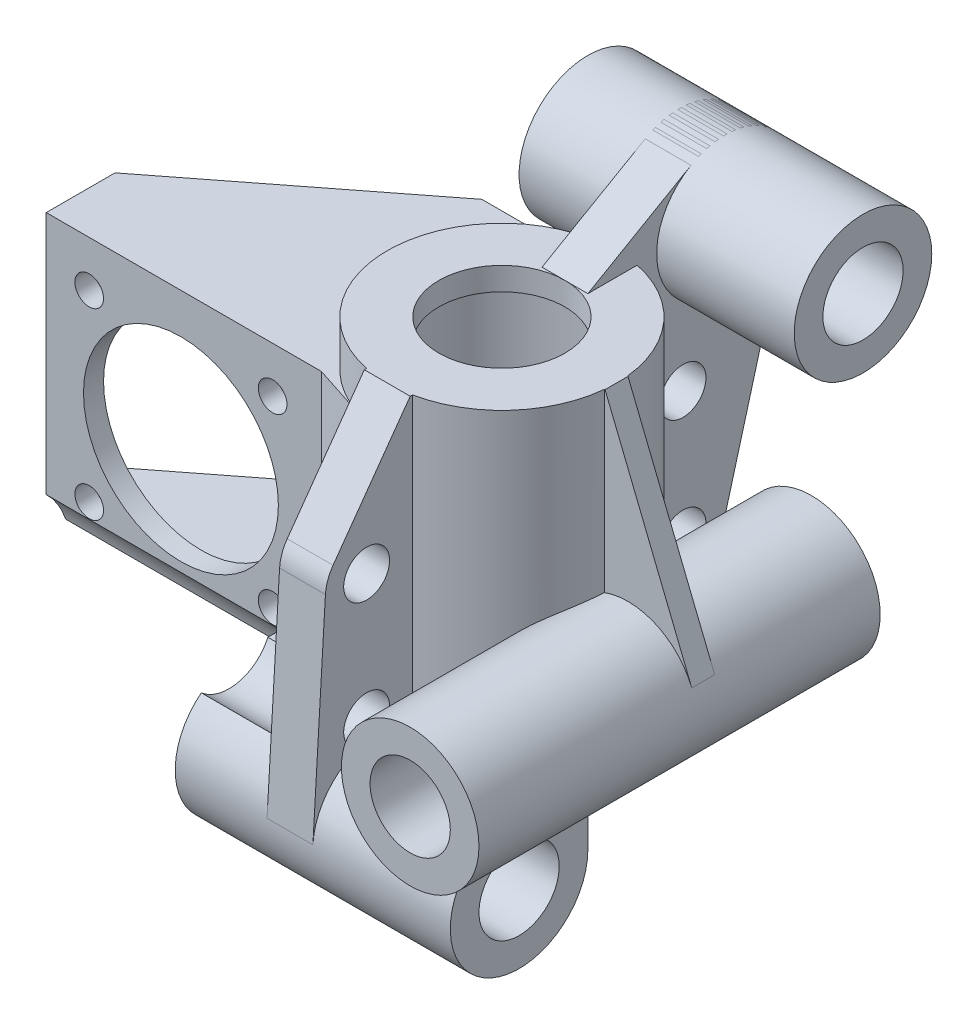
from build123d import *

# Parameters (mm, degrees)
BOSS_EXTRUDE3_DEPTH           = 14
BOSS_EXTRUDE3_DEPTH_BACK      = 10
SKETCH6_R                     = 6
SKETCH6_R_2                   = 3.5
BOSS_EXTRUDE_MOUNT_DEPTH      = 11
BOSS_EXTRUDE_MOUNT_DEPTH_BACK = 13
SKETCH11_R                    = 3.5
SKETCH11_R_2                  = 2
BOSS_EXTRUDE_FLANGE_DEPTH     = 2
CUT_EXTRUDE2_DEPTH            = 10.5
CUT_EXTRUDE2_DEPTH_BACK       = 47.360004387
SKETCH8_W                     = 30
SKETCH8_H                     = 20.5
SKETCH9_R                     = 6.5
CUT_EXTRUDE3_DEPTH            = 40.613760296
SKETCH10_R                    = 8.5
SKETCH10_R_2                  = 1.25
CUT_EXTRUDE4_DEPTH            = 1.75
BOSS_EXTRUDE6_DEPTH           = 20
BOSS_EXTRUDE6_DEPTH_BACK      = 15
SKETCH12_R                    = 6
SKETCH12_R_2                  = 3.5
SKETCH13_R                    = 3
CUT_EXTRUDE5_DEPTH            = 5
SKETCH14_R                    = 3.7
CUT_EXTRUDE6_DEPTH            = 44.339502814
BOSS_EXTRUDE7_DEPTH           = 1
CUT_EXTRUDE7_START            = -2
SKETCH16_R                    = 2
CUT_EXTRUDE7_DEPTH            = 9.5


with BuildPart() as part:
    # Sketch2 → Revolve1 (revolve)
    with BuildSketch(Plane(origin=(0, 0, 0), x_dir=(0, 0, -1), z_dir=(1, 0, 0)), mode=Mode.PRIVATE) as revolve1_sk:
        Polygon((5.5, 15), (5.5, 13), (7.75, 13), (7.75, -13), (5.5, -13), (5.5, -15), (10, -15), (10, 15), align=None)
    revolve(revolve1_sk.sketch.rotate(Axis((0, 15, 0), (0, -1, 0)), 180), axis=Axis((0, 15, 0), (0, -1, 0)))

    # Sketch6 → Boss-Extrude3 (add, two sides: drawn at the far end of the back side and taken through both)
    # profile 1 of 2: a face of its own
    with BuildSketch(Plane(origin=(0, 0, 0), x_dir=(0, 0, -1), z_dir=(1, 0, 0)).offset(-BOSS_EXTRUDE3_DEPTH_BACK)):
        with Locations((17.5, 15)):
            Circle(SKETCH6_R)
        with Locations((17.5, 15)):
            Circle(SKETCH6_R_2, mode=Mode.SUBTRACT)
    # profile 2 of 2: a face of its own
    with BuildSketch(Plane(origin=(0, 0, 0), x_dir=(0, 0, -1), z_dir=(1, 0, 0)).offset(-BOSS_EXTRUDE3_DEPTH_BACK)):
        with BuildLine():
            Line((-12.5, -9), (-6.5, -9))
            Line((-6.5, -9), (-6.5, -15))
            ThreePointArc((-6.5, -15), (-16.742640687, -19.242640687), (-12.5, -9))
        make_face()
        with Locations((-12.5, -15)):
            Circle(SKETCH6_R_2, mode=Mode.SUBTRACT)
    extrude(amount=BOSS_EXTRUDE3_DEPTH + BOSS_EXTRUDE3_DEPTH_BACK)


with BuildPart() as boss_extrude3_piece_1:
    # of the separate pieces the step leaves, piece 1, a body of its own (boss_extrude3_pieces)
    add(part.part.solids().sort_by_distance((0, 15, 5.5))[0])

    # Sketch7 → Boss-Extrude Mount (add, two sides: drawn at the far end of the back side and taken through both)
    with BuildSketch(Plane(origin=(0, 0, 0), x_dir=(1, 0, 0), z_dir=(0, 1, 0)).offset(-BOSS_EXTRUDE_MOUNT_DEPTH_BACK)):
        with BuildLine():
            Line((-7.75, -8), (-31.75, -8))
            Line((-31.75, -8), (-31.75, -2))
            Line((-31.75, -2), (-13.75, 12))
            Line((-13.75, 12), (0, 12))
            Line((0, 12), (0, 10))
            ThreePointArc((0, 10), (-9.877414793, 1.560985907), (-3.083701059, -9.512664599))
            Line((-3.083701059, -9.512664599), (-7.75, -8))
        make_face()
    extrude(amount=BOSS_EXTRUDE_MOUNT_DEPTH + BOSS_EXTRUDE_MOUNT_DEPTH_BACK)

    # Sketch11 → Boss-Extrude Flange (add, symmetric)
    with BuildSketch(Plane(origin=(0, 0, 0), x_dir=(0, 0, -1), z_dir=(1, 0, 0))):
        with BuildLine():
            Line((-10, 15), (5.5, 15))
            Line((5.5, 15), (14.5, 20.196152423))
            ThreePointArc((14.5, 20.196152423), (21.168339425, 19.747977029), (23.28512436, 13.408668439))
            Line((23.28512436, 13.408668439), (17.271074616, -8.454798937))
            ThreePointArc((17.271074616, -8.454798937), (16.791511099, -9.502713495), (16.005385537, -10.345395339))
            Line((16.005385537, -10.345395339), (10, -15))
            Line((10, -15), (-6.5, -15))
            ThreePointArc((-6.5, -15), (-12.678832382, -20.997334323), (-18.48933966, -14.642494138))
            Line((-18.48933966, -14.642494138), (-17.393603796, 3.714503517))
            ThreePointArc((-17.393603796, 3.714503517), (-17.193582714, 4.701497551), (-16.728001829, 5.594470169))
            Line((-16.728001829, 5.594470169), (-10, 15))
        make_face()
        with Locations((-12.5, -15)):
            Circle(SKETCH11_R, mode=Mode.SUBTRACT)
        with Locations((17.5, 15)):
            Circle(SKETCH11_R, mode=Mode.SUBTRACT)
        with Locations((-13.8, -7.5)):
            Circle(SKETCH11_R_2, mode=Mode.SUBTRACT)
        with Locations((-13.8, 3.5)):
            Circle(SKETCH11_R_2, mode=Mode.SUBTRACT)
        with Locations(Location((13.8, 3.5, 0), (0, 0, 154.158067237))):
            Circle(SKETCH11_R_2, mode=Mode.SUBTRACT)
        with Locations(Location((13.8, -7.5, 0), (0, 0, 154.158067237))):
            Circle(SKETCH11_R_2, mode=Mode.SUBTRACT)
    extrude(amount=BOSS_EXTRUDE_FLANGE_DEPTH, both=True)

    # Sketch8 → Cut-Extrude2 (cut, two sides: drawn at the far end of the back side and taken through both)
    with BuildSketch(Plane(origin=(-20, 0, 0), x_dir=(0, 0, -1), z_dir=(1, 0, 0)).offset(-CUT_EXTRUDE2_DEPTH_BACK)):
        with Locations((8.75, -1)):
            Rectangle(SKETCH8_W, SKETCH8_H)
    extrude(amount=CUT_EXTRUDE2_DEPTH + CUT_EXTRUDE2_DEPTH_BACK, mode=Mode.SUBTRACT)

    # Sketch9 → Cut-Extrude3 (cut, through all)
    with BuildSketch(Plane.ZY.offset(10)):
        with Locations((-17.5, 15)):
            Circle(SKETCH9_R)
        with Locations((12.5, -15)):
            Circle(SKETCH9_R)
    extrude(amount=CUT_EXTRUDE3_DEPTH, mode=Mode.SUBTRACT)

    # Sketch10 → Cut-Extrude4 (cut)
    with BuildSketch(Plane.XY.offset(8)):
        with Locations((-20, -1)):
            Circle(SKETCH10_R)
        with Locations((-12, 7)):
            Circle(SKETCH10_R_2)
        with Locations((-28, 7)):
            Circle(SKETCH10_R_2)
        with Locations((-28, -9)):
            Circle(SKETCH10_R_2)
        with Locations((-12, -9)):
            Circle(SKETCH10_R_2)
    extrude(amount=-CUT_EXTRUDE4_DEPTH, mode=Mode.SUBTRACT)

    # Sketch12 → Boss-Extrude6 (add, two sides: drawn at the far end of the back side and taken through both)
    with BuildSketch(Plane.XY.offset(-BOSS_EXTRUDE6_DEPTH_BACK)):
        with Locations((12, -6)):
            Circle(SKETCH12_R)
        with Locations((12, -6)):
            Circle(SKETCH12_R_2, mode=Mode.SUBTRACT)
    extrude(amount=BOSS_EXTRUDE6_DEPTH + BOSS_EXTRUDE6_DEPTH_BACK)

    # Sketch13 → Cut-Extrude5 (cut)
    with BuildSketch(Plane(origin=(2, 0, 0), x_dir=(0, 0, -1), z_dir=(1, 0, 0))):
        with Locations((13.8, 3.5)):
            Circle(SKETCH13_R)
        with Locations((13.8, -7.5)):
            Circle(SKETCH13_R)
        with Locations((-13.8, 3.5)):
            Circle(SKETCH13_R)
        with Locations((-13.8, -7.5)):
            Circle(SKETCH13_R)
    extrude(amount=CUT_EXTRUDE5_DEPTH, mode=Mode.SUBTRACT)

    # Sketch14 → Cut-Extrude6 (cut, through all)
    with BuildSketch(Plane.ZY.offset(2)):
        with Locations((13.8, 3.5)):
            Circle(SKETCH14_R)
        with Locations((13.8, -7.5)):
            Circle(SKETCH14_R)
        with BuildLine():
            Line((-13.8, 7.2), (-21.577287255, 7.2))
            Line((-21.577287255, 7.2), (-21.577287255, -0.2))
            Line((-21.577287255, -0.2), (-13.8, -0.2))
            ThreePointArc((-13.8, -0.2), (-10.1, 3.5), (-13.8, 7.2))
        make_face()
        with BuildLine():
            Line((-13.8, -3.8), (-18.551484163, -3.8))
            Line((-18.551484163, -3.8), (-18.551484163, -11.2))
            Line((-18.551484163, -11.2), (-13.8, -11.2))
            ThreePointArc((-13.8, -11.2), (-10.1, -7.5), (-13.8, -3.8))
        make_face()
    extrude(amount=CUT_EXTRUDE6_DEPTH, mode=Mode.SUBTRACT)

    # Sketch15 → Boss-Extrude7 (add, symmetric)
    with BuildSketch(Plane.XY):
        with BuildLine():
            Line((10, 15), (17.56447708, -3.755764088))
            ThreePointArc((17.56447708, -3.755764088), (6.2205342, -4.38823852), (15.6, -10.8))
            Line((15.6, -10.8), (10, -15))
            Line((10, -15), (5.5, -15))
            Line((5.5, -15), (5.5, 15))
            Line((5.5, 15), (10, 15))
        make_face()
    extrude(amount=BOSS_EXTRUDE7_DEPTH, both=True)

    # Sketch16 → Cut-Extrude7 (cut)
    with BuildSketch(Plane(origin=(0, 0, 0), x_dir=(0, 0, -1), z_dir=(1, 0, 0)).offset(CUT_EXTRUDE7_START)):
        with Locations((-13.8, -7.5)):
            Circle(SKETCH16_R)
        with Locations((-13.8, 3.5)):
            Circle(SKETCH16_R)
        with Locations((13.8, 3.5)):
            Circle(SKETCH16_R)
        with Locations((13.8, -7.5)):
            Circle(SKETCH16_R)
    extrude(amount=CUT_EXTRUDE7_DEPTH, mode=Mode.SUBTRACT)

    # Sketch17 → Cut-Revolve1 (revolve, cut)
    with BuildSketch(Plane(origin=(0, 0, 0), x_dir=(0, 0, -1), z_dir=(1, 0, 0))):
        Polygon((-5.5, 15), (-5.5, 13), (-7.75, 13), (-7.75, -13), (-5.5, -13), (-5.5, -15), (0, -15), (0, 15), align=None)
    revolve(axis=Axis((0, -13, 0), (0, 1, 0)), mode=Mode.SUBTRACT)


with BuildPart() as boss_extrude3_piece_2:
    # of the separate pieces the step leaves, piece 2, a body of its own (boss_extrude3_pieces)
    add(part.part.solids().sort_by_distance((0, 15, -23.5))[0])


solid = Compound([boss_extrude3_piece_1.part, boss_extrude3_piece_2.part])
